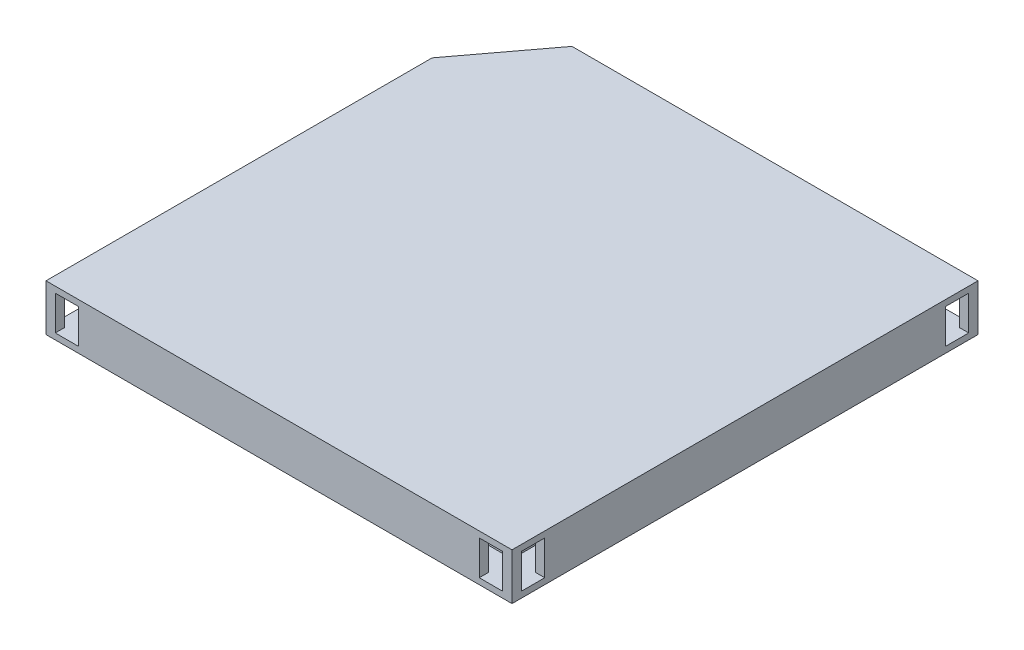
from build123d import *

# Parameters (mm, degrees)
SKETCH1_W               = 100
SKETCH1_H               = 10
BOSS_EXTRUDE1_DEPTH     = 50
SKETCH2_W               = 5.031669049
SKETCH2_H               = 7.399484506
CUT_EXTRUDE1_DEPTH      = 112.915146428
MIRROR2_COPY_1_SKETCH_W = 5.031669049
MIRROR2_COPY_1_SKETCH_H = 7.399484506
MIRROR2_COPY_1_DEPTH    = 112.915146428
MIRROR2_COPY_2_SKETCH_W = 5.031669049
MIRROR2_COPY_2_SKETCH_H = 7.399484506
MIRROR2_COPY_2_DEPTH    = 112.915146428
CUT_EXTRUDE2_DEPTH      = 72.414284285


with BuildPart() as part:
    # Sketch1 → Boss-Extrude1 (new, symmetric)
    with BuildSketch(Plane.XY):
        Rectangle(SKETCH1_W, SKETCH1_H)
    extrude(amount=BOSS_EXTRUDE1_DEPTH, both=True)

    # Sketch2 → Cut-Extrude1 (cut, through all)
    with BuildSketch(Plane.XY.offset(50)):
        with Locations((45.494674326, 0)):
            Rectangle(SKETCH2_W, SKETCH2_H)
    cut_extrude1 = extrude(amount=-CUT_EXTRUDE1_DEPTH, mode=Mode.SUBTRACT)

    # Mirror1: Cut-Extrude1 across plane
    add(cut_extrude1.mirror(Plane(origin=(0, 0, 0), x_dir=(0.7071067811865476, 0, 0.7071067811865476), z_dir=(-0.7071067811865477, 0, 0.7071067811865475))), mode=Mode.SUBTRACT)

    # Mirror2 copy 1 sketch → Mirror2 copy 1 (cut, through all)
    with BuildSketch(Plane(origin=(0, 0, -50), x_dir=(-1, 0, 0), z_dir=(0, 0, -1))):
        with Locations((45.494674326, 0)):
            Rectangle(MIRROR2_COPY_1_SKETCH_W, MIRROR2_COPY_1_SKETCH_H)
    extrude(amount=-MIRROR2_COPY_1_DEPTH, mode=Mode.SUBTRACT)

    # Mirror2 copy 2 sketch → Mirror2 copy 2 (cut, through all)
    with BuildSketch(Plane(origin=(-50, 0, 0), x_dir=(0, 0, -1), z_dir=(-1, 0, 0))):
        with Locations((45.494674326, 0)):
            Rectangle(MIRROR2_COPY_2_SKETCH_W, MIRROR2_COPY_2_SKETCH_H)
    extrude(amount=-MIRROR2_COPY_2_DEPTH, mode=Mode.SUBTRACT)

    # Sketch3 → Cut-Extrude2 (cut, through all)
    with BuildSketch(Plane(origin=(0, 5, 0), x_dir=(1, 0, 0), z_dir=(0, 1, 0))):
        Polygon((-226.207235665, -201.784596614), (-53.944301898, 27.606350902), (-24.696492293, 66.553689202), (147.566441474, 295.944636718), (-311.215453559, 640.470504252), (-684.989130698, 142.74127092), align=None)
    extrude(amount=-CUT_EXTRUDE2_DEPTH, mode=Mode.SUBTRACT)


solid = part.part
